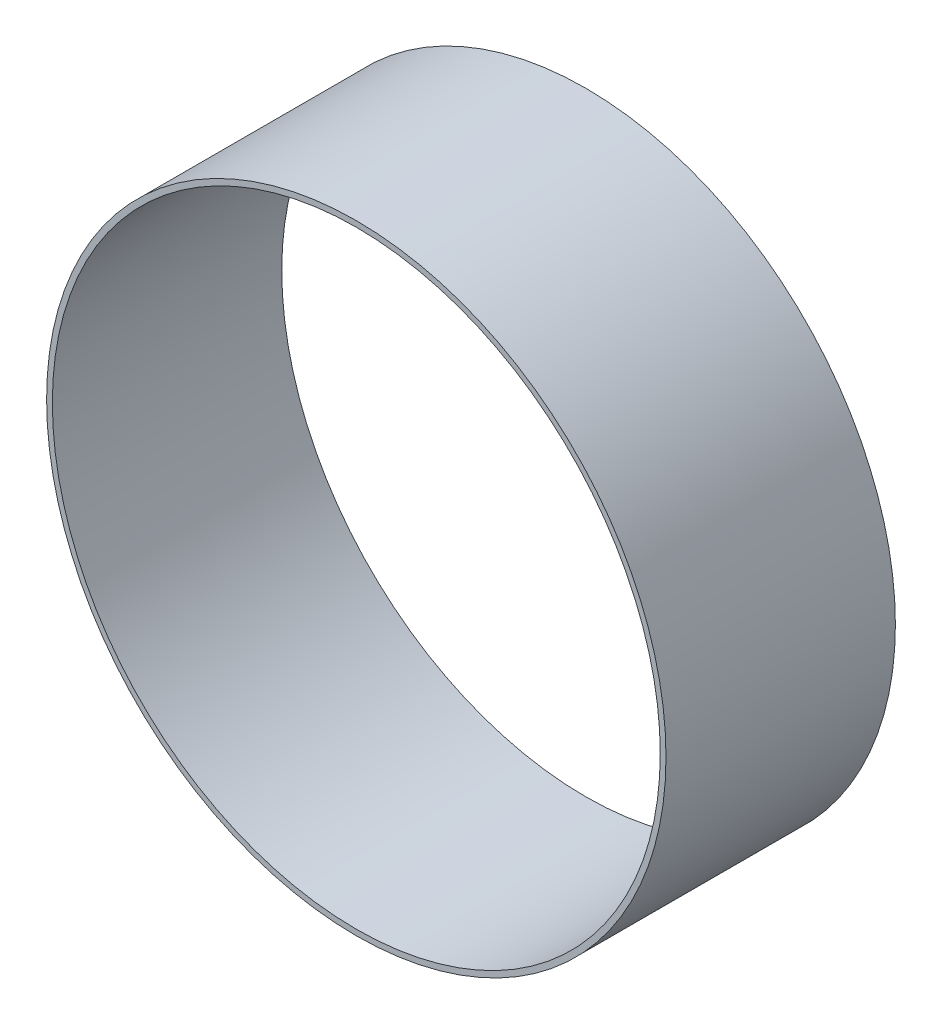
from build123d import *

# Parameters (mm, degrees)
SKETCH_1_R      = 10.8
SKETCH_1_R_2    = 10.6
EXTRUDE_1_DEPTH = 8


with BuildPart() as part:
    # 草图1 → 凸台-拉伸1 (new body)
    with BuildSketch(Plane.XY):
        Circle(SKETCH_1_R)
        Circle(SKETCH_1_R_2, mode=Mode.SUBTRACT)
    extrude(amount=EXTRUDE_1_DEPTH)


solid = part.part
